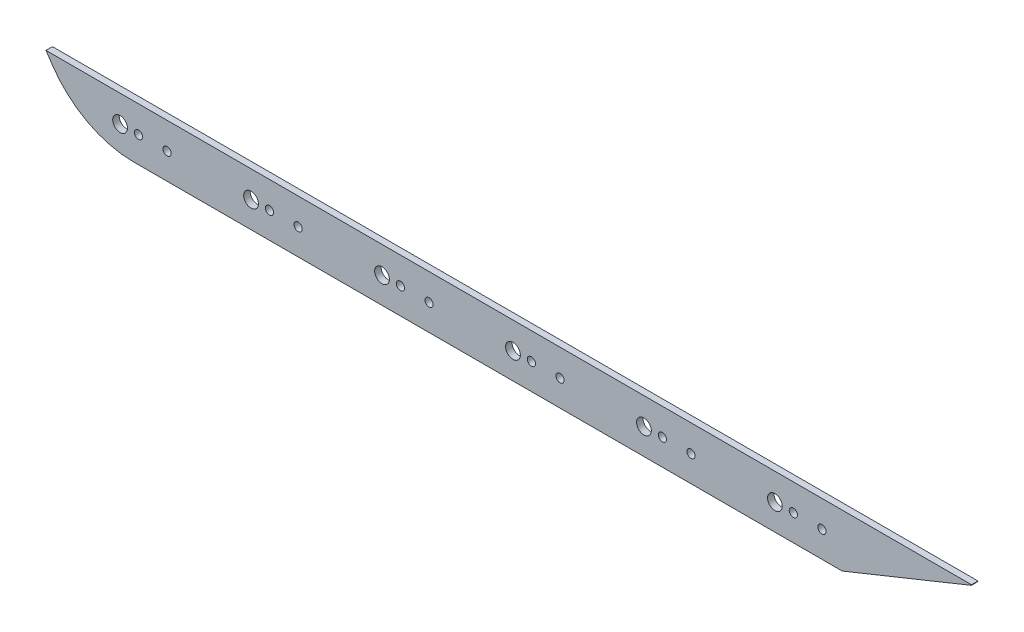
from build123d import *

# Parameters (mm, degrees)
BOSS_EXTRUDE1_DEPTH = 3.175
SKETCH1_4_R         = 3.6
CUT_EXTRUDE1_DEPTH  = 439.905857431
FILLET1_R           = 48
CUT_EXTRUDE3_DEPTH  = 10
CUT_EXTRUDE5_DEPTH  = 10
SKETCH11_R          = 2
CUT_EXTRUDE6_DEPTH  = 10


with BuildPart() as part:
    # Sketch1 → Boss-Extrude1 (new body)
    with BuildSketch(Plane.XY):
        Polygon((428.120588235, 28.939617947), (0.540381846, 28.939617947), (-115.605170134, 28.939617947), (-98.879411765, 3.850980392), (-31.879411765, -96.649019608), (366, -96.649019608), (403.120588235, -71.149019608), align=None)
    extrude(amount=BOSS_EXTRUDE1_DEPTH)

    # Sketch1<4> → Cut-Extrude1 (cut, through all)
    with BuildSketch(Plane.XY):
        with Locations((-12.879411765, -83.899019608)):
            Circle(SKETCH1_4_R)
        with Locations((51.120588235, -83.899019608)):
            Circle(SKETCH1_4_R)
        with Locations((115.120588235, -83.899019608)):
            Circle(SKETCH1_4_R)
        with Locations((179.120588235, -83.899019608)):
            Circle(SKETCH1_4_R)
        with Locations((243.120588235, -83.899019608)):
            Circle(SKETCH1_4_R)
        with Locations((307.120588235, -83.899019608)):
            Circle(SKETCH1_4_R)
    extrude(amount=CUT_EXTRUDE1_DEPTH, mode=Mode.SUBTRACT)

    # Fillet1
    fillet1_edges = [part.edges().sort_by_distance(p)[0] for p in [
        (-31.879411765, -96.649019608, 1.5875),
    ]]
    fillet(fillet1_edges, radius=FILLET1_R)

    # Sketch7 → Cut-Extrude3 (cut)
    with BuildSketch(Plane.XY.offset(3.175)):
        Polygon((403.120588235, -71.149019608), (340.005873473, -96.649019608), (366, -96.649019608), align=None)
    extrude(amount=-CUT_EXTRUDE3_DEPTH, mode=Mode.SUBTRACT)

    # Sketch10 → Cut-Extrude5 (cut)
    with BuildSketch(Plane.XY.offset(3.175)):
        Polygon((-49.086078431, -70.839019608), (403.198019602, -70.839019608), (428.120588235, 28.939617947), (-115.605170134, 28.939617947), align=None)
    extrude(amount=-CUT_EXTRUDE5_DEPTH, mode=Mode.SUBTRACT)

    # Sketch11 → Cut-Extrude6 (cut)
    with BuildSketch(Plane.XY.offset(3.175)):
        with Locations((-3.879411765, -83.899019608)):
            Circle(SKETCH11_R)
        with Locations((10.120588235, -83.899019608)):
            Circle(SKETCH11_R)
        with Locations((60.120588235, -83.899019608)):
            Circle(SKETCH11_R)
        with Locations((74.120588235, -83.899019608)):
            Circle(SKETCH11_R)
        with Locations((124.120588235, -83.899019608)):
            Circle(SKETCH11_R)
        with Locations((138.120588235, -83.899019608)):
            Circle(SKETCH11_R)
        with Locations((188.120588235, -83.899019608)):
            Circle(SKETCH11_R)
        with Locations((202.120588235, -83.899019608)):
            Circle(SKETCH11_R)
        with Locations((252.120588235, -83.899019608)):
            Circle(SKETCH11_R)
        with Locations((266.120588235, -83.899019608)):
            Circle(SKETCH11_R)
        with Locations((316.120588235, -83.899019608)):
            Circle(SKETCH11_R)
        with Locations((330.120588235, -83.899019608)):
            Circle(SKETCH11_R)
    extrude(amount=-CUT_EXTRUDE6_DEPTH, mode=Mode.SUBTRACT)


solid = part.part
